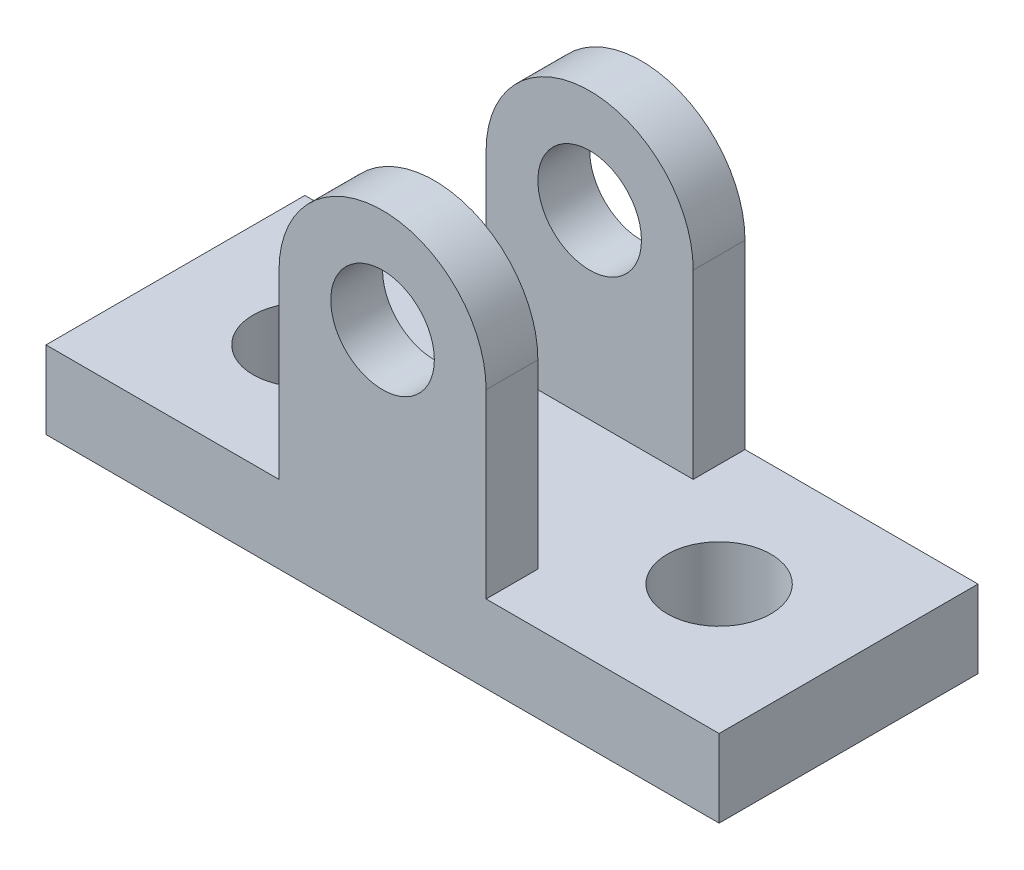
from build123d import *

# Parameters (mm, degrees)
BOSS_EXTRUDE1_DEPTH = 50
SKETCH2_R           = 10
CUT_EXTRUDE1_DEPTH  = 25
SKETCH2_3_R         = 10
CUT_EXTRUDE2_DEPTH  = 25
SKETCH3_W           = 40
SKETCH3_H           = 30
CUT_EXTRUDE3_DEPTH  = 99.742088291
SKETCH4_R           = 10
CUT_EXTRUDE4_DEPTH  = 108.819293264


with BuildPart() as part:
    # Sketch1 → Boss-Extrude1 (new body)
    with BuildSketch(Plane.XY):
        with BuildLine():
            Line((-65, 0), (-65, 15))
            Line((-65, 15), (-20, 15))
            Line((-20, 15), (-20, 50))
            ThreePointArc((-20, 50), (0, 70), (20, 50))
            Line((20, 50), (20, 15))
            Line((20, 15), (65, 15))
            Line((65, 15), (65, 0))
            Line((65, 0), (-65, 0))
        make_face()
    extrude(amount=BOSS_EXTRUDE1_DEPTH)

    # Sketch2 → Cut-Extrude1 (cut)
    with BuildSketch(Plane(origin=(0, 15, 0), x_dir=(1, 0, 0), z_dir=(0, 1, 0))):
        with Locations((-40, -25)):
            Circle(SKETCH2_R)
    extrude(amount=-CUT_EXTRUDE1_DEPTH, mode=Mode.SUBTRACT)

    # Sketch2<3> → Cut-Extrude2 (cut)
    with BuildSketch(Plane(origin=(0, 15, 0), x_dir=(1, 0, 0), z_dir=(0, 1, 0))):
        with Locations((40, -25)):
            Circle(SKETCH2_3_R)
    extrude(amount=-CUT_EXTRUDE2_DEPTH, mode=Mode.SUBTRACT)

    # Sketch3 → Cut-Extrude3 (cut, through all)
    with BuildSketch(Plane(origin=(0, 15, 0), x_dir=(1, 0, 0), z_dir=(0, 1, 0))):
        with Locations((0, -25)):
            Rectangle(SKETCH3_W, SKETCH3_H)
    extrude(amount=CUT_EXTRUDE3_DEPTH, mode=Mode.SUBTRACT)

    # Sketch4 → Cut-Extrude4 (cut, through all)
    with BuildSketch(Plane.XY.offset(50)):
        with Locations((0, 50)):
            Circle(SKETCH4_R)
    extrude(amount=-CUT_EXTRUDE4_DEPTH, mode=Mode.SUBTRACT)


solid = part.part
